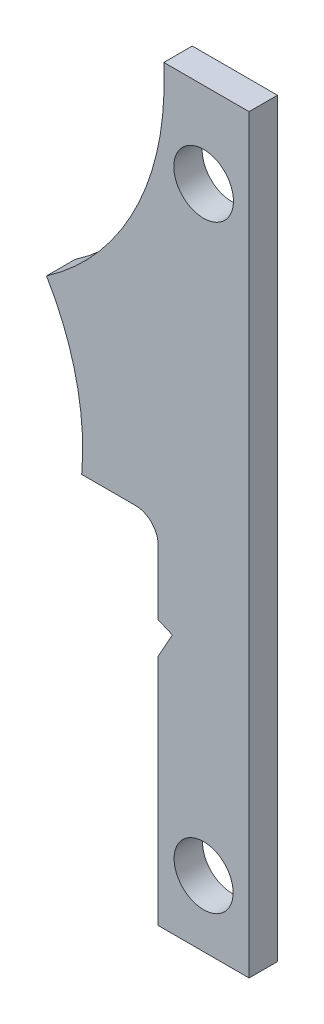
from build123d import *

# Parameters (mm, degrees)
MODEL_R             = 5.191903136
MODEL_R_2           = 5.25
BOSS_EXTRUDE1_DEPTH = 5
SKETCH3_R           = 45.25
CUT_EXTRUDE1_DEPTH  = 6


with BuildPart() as part:
    # Model → Boss-Extrude1 (new body)
    with BuildSketch(Plane.XY):
        with BuildLine():
            Line((869.6, 129.800004709), (854.6, 129.800004709))
            Line((854.6, 129.800004709), (854.6, 124.800004709))
            ThreePointArc((854.6, 124.800004709), (842.940279, 95.005240735), (815.123335737, 79.19718198))
            ThreePointArc((815.123335737, 79.19718198), (819.577050566, 70.004649675), (820.028101645, 59.800004709))
            Line((820.028101645, 59.800004709), (849.60000149, 59.800004709))
            ThreePointArc((849.60000149, 59.800004709), (852.428428615, 58.628431833), (853.60000149, 55.800004709))
            Line((853.60000149, 55.800004709), (853.60000149, 44.400154403))
            Line((853.60000149, 44.400154403), (856.099999799, 43.300004388))
            Line((856.099999799, 43.300004388), (853.60000149, 38.829377357))
            Line((853.60000149, 38.829377357), (853.60000149, -2.199993903))
            Line((853.60000149, -2.199993903), (869.6, -2.199993903))
            Line((869.6, -2.199993903), (869.6, 129.800004709))
        make_face()
        with Locations((861.6, 9.391497171)):
            Circle(MODEL_R, mode=Mode.SUBTRACT)
        with Locations((861.6, 114.800004709)):
            Circle(MODEL_R_2, mode=Mode.SUBTRACT)
    extrude(amount=BOSS_EXTRUDE1_DEPTH)

    # Sketch3 → Cut-Extrude1 (cut)
    with BuildSketch(Plane(origin=(0, 0, 0), x_dir=(-1, 0, 0), z_dir=(0, 0, -1))):
        with Locations((-795.076378777, 63.809415284)):
            Circle(SKETCH3_R)
    extrude(amount=-CUT_EXTRUDE1_DEPTH, mode=Mode.SUBTRACT)


solid = part.part
